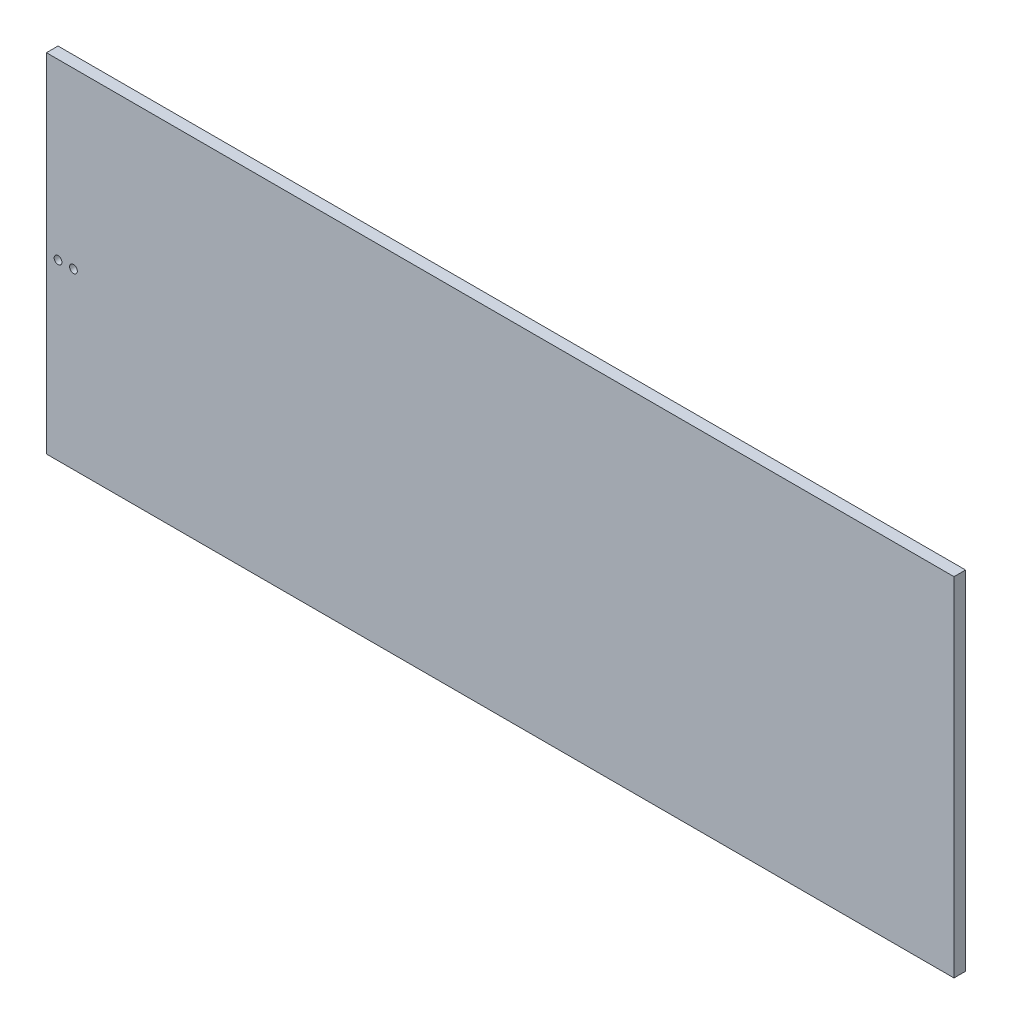
from build123d import *

# Parameters (mm, degrees)
SKETCH_1_W          = 235
SKETCH_1_H          = 90
EXTRUDE_1_DEPTH     = 3
SKETCH_2_W          = 1
SKETCH_2_H          = 8
CUT_EXTRUDE_1_DEPTH = 10
SKETCH_3_R          = 1
CUT_EXTRUDE_2_DEPTH = 10


with BuildPart() as part:
    # 草图1 → 凸台-拉伸1 (new body)
    with BuildSketch(Plane.XY):
        Rectangle(SKETCH_1_W, SKETCH_1_H)
    extrude(amount=EXTRUDE_1_DEPTH)

    # 草图2 → 切除-拉伸1 (cut)
    with BuildSketch(Plane.ZY.offset(117.5)):
        with Locations((0.5, 0)):
            Rectangle(SKETCH_2_W, SKETCH_2_H)
    extrude(amount=-CUT_EXTRUDE_1_DEPTH, mode=Mode.SUBTRACT)

    # 草图3 → 切除-拉伸2 (cut)
    with BuildSketch(Plane(origin=(0, 0, 1), x_dir=(-1, 0, 0), z_dir=(0, 0, -1))):
        with Locations(Location((110.5, 0, 0), (0, 0, 90))):
            Circle(SKETCH_3_R)
        with Locations(Location((114.5, 0, 0), (0, 0, 90))):
            Circle(SKETCH_3_R)
    extrude(amount=-CUT_EXTRUDE_2_DEPTH, mode=Mode.SUBTRACT)


solid = part.part
